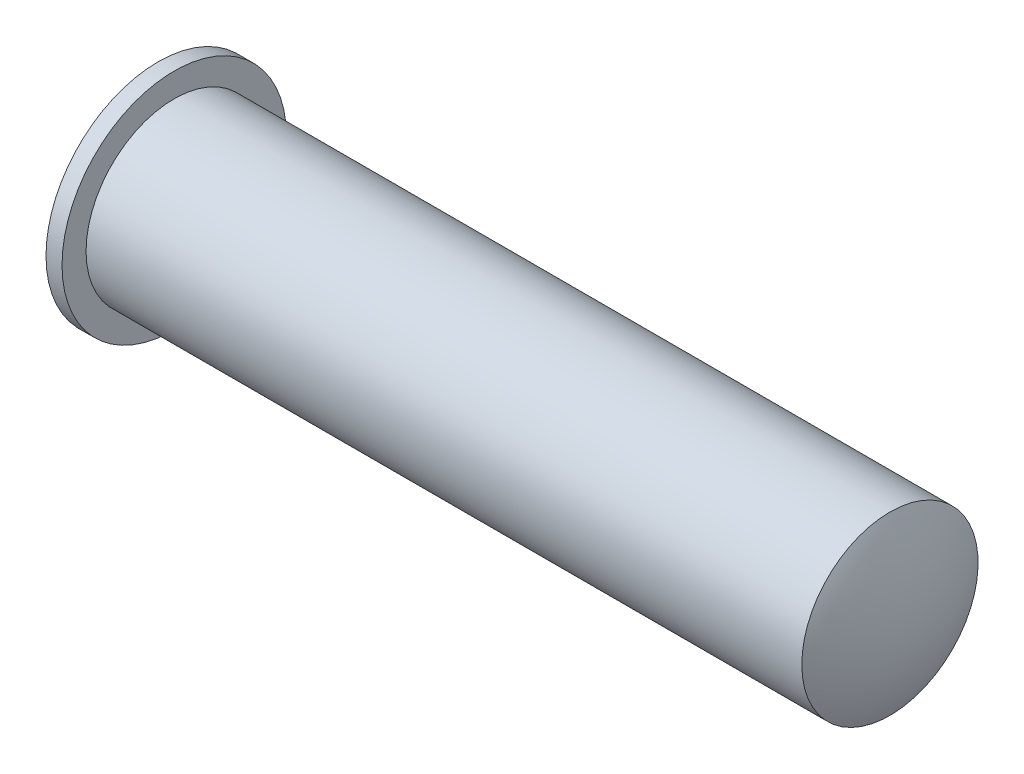
from build123d import *


with BuildPart() as part:
    # 草图1 → 旋转1 (revolve)
    with BuildSketch(Plane.XY):
        with BuildLine():
            Line((0, 7), (1, 7))
            Line((1, 7), (1, 5.5))
            Line((1, 5.5), (45.665364504, 5.5))
            ThreePointArc((45.665364504, 5.5), (46.661568806, 2.82980794), (47, 0))
            Line((47, 0), (-2, 0))
            ThreePointArc((-2, 0), (-1.490192306, 3.640054945), (0, 7))
        make_face()
    revolve(axis=Axis((-2, 0, 0), (1, 0, 0)))


solid = part.part
